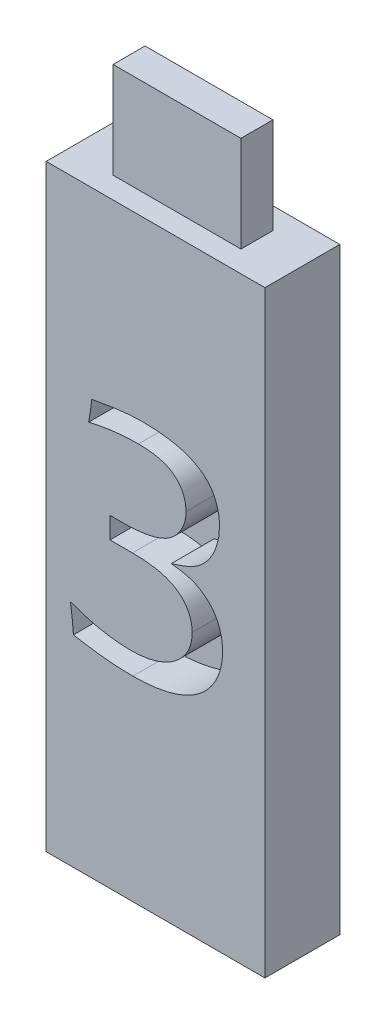
from build123d import *

# Parameters (mm, degrees)
SKETCH1_W           = 17.38
SKETCH1_H           = 47.498
BOSS_EXTRUDE1_DEPTH = 5.95
CUT_EXTRUDE1_DEPTH  = 3.41
SKETCH3_W           = 10.16
SKETCH3_H           = 2.54
BOSS_EXTRUDE2_DEPTH = 7.62


with BuildPart() as part:
    # Sketch1 → Boss-Extrude1 (new body)
    with BuildSketch(Plane.XY):
        Rectangle(SKETCH1_W, SKETCH1_H)
    extrude(amount=BOSS_EXTRUDE1_DEPTH)

    # Sketch2 → Cut-Extrude1 (cut)
    with BuildSketch(Plane.XY.offset(5.95)):
        with BuildLine():
            add(Edge.make_bspline(
                [(-6.52556172, -7.745867902), (-6.541736639, -7.548099343), (-6.573175083, -7.163705708), (-6.622418565, -6.602266915), (-6.692949133, -6.075060478), (-6.743124974, -5.734210105), (-6.767407423, -5.569256574)],
                knots=[0, 0, 0, 0, 1.086986854, 2.112726256, 3.08665945, 4, 4, 4, 4], degree=3))
            add(Edge.make_bspline(
                [(-6.767407423, -5.569256574), (-6.530107504, -5.65714284), (-6.071226782, -5.827093648), (-5.393252267, -6.037243911), (-4.756216501, -6.210347647), (-4.152431156, -6.334769991), (-3.57872429, -6.427846187), (-3.025776205, -6.484148091), (-2.49184335, -6.53213088), (-2.140956001, -6.53515245), (-1.968281752, -6.536639386)],
                knots=[0, 0, 0, 0, 1.233271994, 2.384850126, 3.458654952, 4.449698821, 5.388467082, 6.290264974, 7.158626795, 8, 8, 8, 8], degree=3))
            add(Edge.make_bspline(
                [(-1.968281752, -6.536639386), (-1.75133924, -6.531980014), (-1.327278106, -6.522872262), (-0.706888473, -6.439166817), (-0.115695472, -6.315014093), (0.441587435, -6.128655567), (0.959134586, -5.891680706), (1.434346256, -5.60536251), (1.852688666, -5.254947102), (2.223631893, -4.861847073), (2.530540018, -4.420139374), (2.745748542, -3.932531949), (2.886322279, -3.410547349), (2.899628723, -3.048438292), (2.906420702, -2.86360777)],
                knots=[0, 0, 0, 0, 1.146655432, 2.241386427, 3.304909894, 4.337056057, 5.341489706, 6.310260062, 7.261210465, 8.21792905, 9.162042711, 10.089298595, 11.024724922, 12, 12, 12, 12], degree=3))
            add(Edge.make_bspline(
                [(2.906420702, -2.86360777), (2.901024718, -2.714484768), (2.890393101, -2.420670199), (2.793891256, -1.993867016), (2.631400278, -1.594911679), (2.411871676, -1.222767409), (2.129631062, -0.880783066), (1.777265044, -0.58591917), (1.362310422, -0.334947261), (0.882019785, -0.126391182), (0.326060942, 0.041506515), (-0.317039003, 0.152592763), (-1.047099623, 0.225103406), (-1.563744548, 0.231610819), (-1.836022383, 0.235040301)],
                knots=[0, 0, 0, 0, 0.838837545, 1.652747662, 2.448248001, 3.255922832, 4.076848485, 4.9323124, 5.830012564, 6.798601416, 7.873321705, 9.091954711, 10.467426588, 12, 12, 12, 12], degree=3))
            add(Edge.make_bspline(
                [(-1.836022383, 0.235040301), (-2.118175703, 0.235040301), (-2.71397267, 0.235040301), (-3.309769636, 0.235040301), (-3.623413283, 0.235040301)],
                knots=[0, 0, 0, 0, 0.947145877, 2, 2, 2, 2], degree=3))
            add(Edge.make_bspline(
                [(-3.623413283, 0.235040301), (-3.623413283, 0.401309222), (-3.623413283, 0.716212481), (-3.623413283, 1.164634723), (-3.623413283, 1.562672442), (-3.623413283, 1.812075824), (-3.623413283, 1.927960223)],
                knots=[0, 0, 0, 0, 1.178571429, 2.232142857, 3.178571429, 4, 4, 4, 4], degree=3))
            add(Edge.make_bspline(
                [(-3.623413283, 1.927960223), (-3.414317518, 1.927960223), (-3.017539412, 1.927960223), (-2.620761305, 1.927960223), (-2.433078962, 1.927960223)],
                knots=[0, 0, 0, 0, 1.053968254, 2, 2, 2, 2], degree=3))
            add(Edge.make_bspline(
                [(-2.433078962, 1.927960223), (-2.213703602, 1.930624231), (-1.782777551, 1.935857226), (-1.151023939, 2.0055806), (-0.542619853, 2.10015175), (0.035880784, 2.240575523), (0.575646904, 2.432273783), (1.055902319, 2.692411738), (1.469541725, 3.020520175), (1.811722492, 3.405969987), (2.08288473, 3.830741215), (2.27766536, 4.278496537), (2.402253448, 4.741516196), (2.415895086, 5.057332232), (2.422729296, 5.21555025)],
                knots=[0, 0, 0, 0, 1.198563504, 2.354376706, 3.470500059, 4.562664134, 5.603894105, 6.593029745, 7.533946595, 8.475140529, 9.397714259, 10.276520456, 11.136568486, 12, 12, 12, 12], degree=3))
            add(Edge.make_bspline(
                [(2.422729296, 5.21555025), (2.41848686, 5.321507932), (2.410108472, 5.530763797), (2.361808308, 5.839798802), (2.272318537, 6.136976064), (2.152371646, 6.424223648), (1.999138717, 6.693438231), (1.814730838, 6.941867492), (1.595760775, 7.159214462), (1.345598912, 7.350011462), (1.071173531, 7.516024108), (0.768770465, 7.652369954), (0.443224079, 7.761631168), (-0.02126237, 7.869550376), (-0.625047542, 7.953947292), (-1.113972164, 7.967357708), (-1.359888655, 7.974102801)],
                knots=[0, 0, 0, 0, 0.840069058, 1.659052692, 2.470886163, 3.294117981, 4.121275006, 4.91992718, 5.738789114, 6.557468464, 7.408382134, 8.275078447, 9.181128571, 10.125473558, 12.051213004, 14, 14, 14, 14], degree=3))
            add(Edge.make_bspline(
                [(-1.359888655, 7.974102801), (-1.673695553, 7.969028927), (-2.28838471, 7.959090155), (-3.055728965, 7.892689053), (-3.677904349, 7.813221258), (-4.183457732, 7.722552933), (-4.735878517, 7.618644903), (-5.117536064, 7.534329474), (-5.316333204, 7.490411395)],
                knots=[0, 0, 0, 0, 1.413699745, 2.769173996, 3.467485544, 4.239092287, 5.082781358, 6, 6, 6, 6], degree=3))
            add(Edge.make_bspline(
                [(-5.316333204, 7.490411395), (-5.295473469, 7.596092866), (-5.249427147, 7.829376891), (-5.190410995, 8.217774099), (-5.130669891, 8.676445311), (-5.094041399, 9.006913098), (-5.074487501, 9.183331317)],
                knots=[0, 0, 0, 0, 0.755535026, 1.667787633, 2.754962612, 4, 4, 4, 4], degree=3))
            add(Edge.make_bspline(
                [(-5.074487501, 9.183331317), (-4.839061429, 9.226846422), (-4.393892492, 9.309129464), (-3.762770018, 9.415006617), (-3.207342126, 9.499542218), (-2.574147348, 9.578446025), (-1.850277468, 9.651295087), (-1.284507474, 9.661865299), (-1.008456617, 9.667022723)],
                knots=[0, 0, 0, 0, 1.050947891, 1.987245303, 2.809118091, 3.516901663, 4.788445072, 6, 6, 6, 6], degree=3))
            add(Edge.make_bspline(
                [(-1.008456617, 9.667022723), (-0.787984528, 9.663669776), (-0.351690808, 9.657034605), (0.292002393, 9.617988713), (0.915587457, 9.538862965), (1.515964453, 9.441265363), (2.084281473, 9.307972062), (2.610568352, 9.135217425), (3.086978216, 8.919091142), (3.518718882, 8.670307938), (3.898229552, 8.382060206), (4.228524929, 8.059813131), (4.498719018, 7.696298707), (4.713843094, 7.300619566), (4.879671631, 6.881272468), (4.99630019, 6.442360068), (5.071173168, 5.989007724), (5.079061327, 5.680639804), (5.08303203, 5.525415057)],
                knots=[0, 0, 0, 0, 1.266958933, 2.507193661, 3.702999241, 4.87743226, 6.000982662, 7.053838483, 8.05478712, 9.001953689, 9.911049213, 10.786233696, 11.644646876, 12.503029542, 13.3672512, 14.229318255, 15.108682819, 16, 16, 16, 16], degree=3))
            add(Edge.make_bspline(
                [(5.08303203, 5.525415057), (5.073346612, 5.29136261), (5.053796783, 4.818932278), (4.907815231, 4.243673456), (4.760384651, 3.797657776), (4.628071558, 3.484699001), (4.479730584, 3.193737158), (4.263994326, 2.846554659), (3.965197708, 2.465414494), (3.563814241, 2.084654396), (3.127194483, 1.784257241), (2.736903149, 1.573559514), (2.382780475, 1.423099561), (2.056319362, 1.304292136), (1.671494725, 1.171074546), (1.392673252, 1.085594852), (1.243731493, 1.039933032)],
                knots=[0, 0, 0, 0, 1.526412492, 3.08103406, 3.853748594, 4.594850058, 5.297651013, 5.984869021, 7.262097787, 8.449404989, 9.583765836, 10.713822146, 11.340398739, 12.095345308, 12.982565373, 14, 14, 14, 14], degree=3))
            add(Edge.make_bspline(
                [(1.243731493, 1.039933032), (1.403759525, 1.020356376), (1.704175687, 0.983605665), (2.122673042, 0.923789077), (2.475141845, 0.846858293), (2.864130218, 0.743713734), (3.303014609, 0.555758637), (3.794772208, 0.258479198), (4.254320263, -0.114504015), (4.574491765, -0.49806429), (4.798045633, -0.832017921), (4.936330324, -1.107824276), (5.058160875, -1.397737762), (5.187274335, -1.807722085), (5.303551629, -2.343509578), (5.317731548, -2.782293192), (5.324877733, -3.003424817)],
                knots=[0, 0, 0, 0, 1.05140306, 1.973769637, 2.755120881, 3.402765032, 4.595667385, 5.852196341, 7.141559267, 8.435179725, 9.093568746, 9.758483696, 10.443391522, 11.14214712, 12.559741904, 14, 14, 14, 14], degree=3))
            add(Edge.make_bspline(
                [(5.324877733, -3.003424817), (5.318853578, -3.20043409), (5.306908792, -3.591067038), (5.195219007, -4.166898163), (5.021598461, -4.725154765), (4.780241026, -5.261346273), (4.473837665, -5.76351089), (4.109742558, -6.225711012), (3.681374753, -6.635564365), (3.200544791, -6.997013579), (2.674933003, -7.311812541), (2.107945699, -7.568355733), (1.514168959, -7.792857134), (0.885662086, -7.953548794), (0.235517943, -8.078548986), (-0.432333007, -8.163130761), (-1.114600952, -8.218254877), (-1.57391487, -8.225766961), (-1.80579167, -8.229559308)],
                knots=[0, 0, 0, 0, 0.951341382, 1.886333989, 2.824097537, 3.772375449, 4.720457901, 5.660826572, 6.608087648, 7.57733893, 8.562991247, 9.562683413, 10.581673707, 11.627217792, 12.693490673, 13.78016521, 14.879354254, 16, 16, 16, 16], degree=3))
            add(Edge.make_bspline(
                [(-1.80579167, -8.229559308), (-2.149802637, -8.224115148), (-2.847428076, -8.213074847), (-3.73293587, -8.146076159), (-4.482524718, -8.068898196), (-5.10897433, -7.976987959), (-5.797472847, -7.874373492), (-6.276345169, -7.789853906), (-6.52556172, -7.745867902)],
                knots=[0, 0, 0, 0, 1.303243722, 2.642869155, 3.362762632, 4.157791809, 5.041271022, 6, 6, 6, 6], degree=3))
        make_face()
    extrude(amount=-CUT_EXTRUDE1_DEPTH, mode=Mode.SUBTRACT)

    # Sketch3 → Boss-Extrude2 (add)
    with BuildSketch(Plane(origin=(0, 23.749, 0), x_dir=(1, 0, 0), z_dir=(0, 1, 0))):
        with Locations((0, -2.975)):
            Rectangle(SKETCH3_W, SKETCH3_H)
    extrude(amount=BOSS_EXTRUDE2_DEPTH)


solid = part.part
